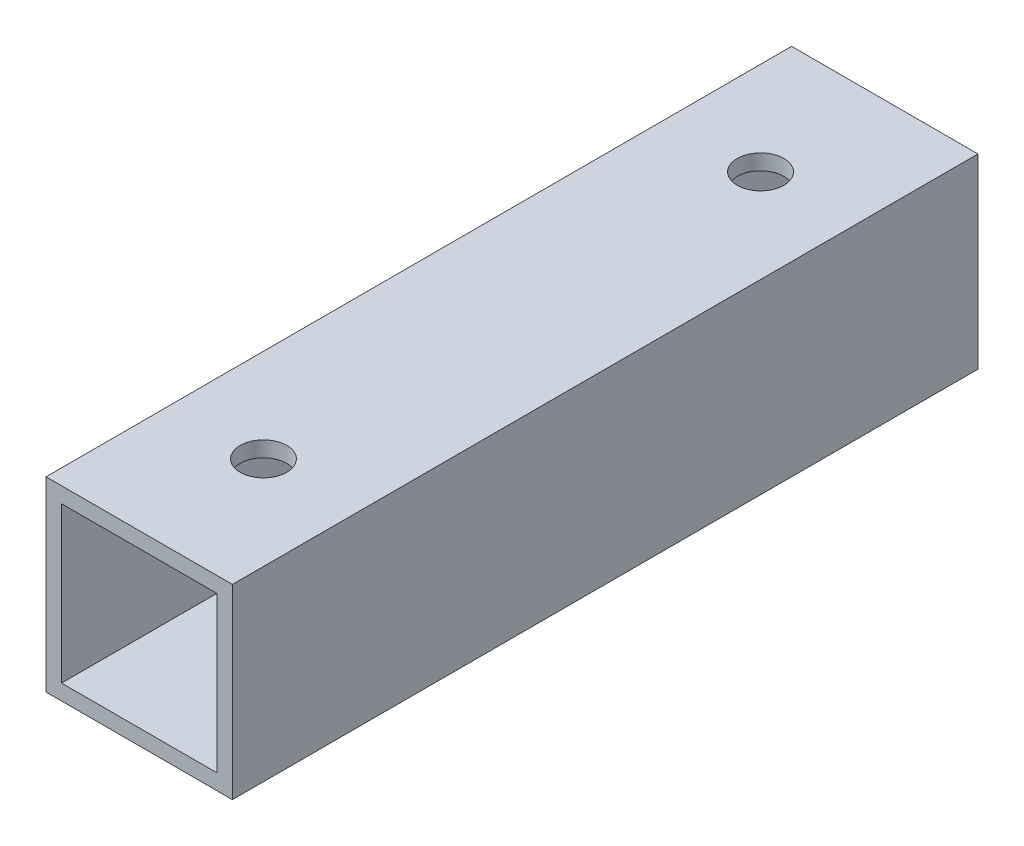
from build123d import *

# Parameters (mm, degrees)
SKETCH1_W               = 19.05
SKETCH1_H               = 19.05
SKETCH1_W_2             = 15.875
SKETCH1_H_2             = 15.875
BOSS_EXTRUDE1_DEPTH     = 76.2
CUT_EXTRUDE1_DEPTH      = 78.381465804
CUT_EXTRUDE1_DEPTH_BACK = 78.381465804
SKETCH2_R               = 2.38125
CUT_EXTRUDE2_REACH      = 81.121
SKETCH3_R               = 3.96875


with BuildPart() as part:
    # Sketch1 → Boss-Extrude1 (new body)
    with BuildSketch(Plane.XY):
        Rectangle(SKETCH1_W, SKETCH1_H)
        Rectangle(SKETCH1_W_2, SKETCH1_H_2, mode=Mode.SUBTRACT)
    extrude(amount=BOSS_EXTRUDE1_DEPTH)

    # Sketch2 → Cut-Extrude1 (cut, two sides: drawn at the far end of the back side and taken through both)
    with BuildSketch(Plane(origin=(0, 0, 0), x_dir=(1, 0, 0), z_dir=(0, 1, 0)).offset(-CUT_EXTRUDE1_DEPTH_BACK)):
        with Locations(Location((0, -12.7, 0), (0, 0, 270))):
            Circle(SKETCH2_R)
        with Locations(Location((0, -63.5, 0), (0, 0, 270))):
            Circle(SKETCH2_R)
    extrude(amount=CUT_EXTRUDE1_DEPTH + CUT_EXTRUDE1_DEPTH_BACK, mode=Mode.SUBTRACT)

    # Sketch3 → Cut-Extrude2 (cut, up to next)
    with BuildSketch(Plane.ZY.offset(9.525), mode=Mode.PRIVATE) as cut_extrude2_sk1:
        with Locations((38.1, 0)):
            Circle(SKETCH3_R)
    cut_extrude2_tool1 = extrude(cut_extrude2_sk1.sketch, amount=-CUT_EXTRUDE2_REACH, mode=Mode.PRIVATE) & part.part
    add(cut_extrude2_tool1.solids().sort_by_distance((-9.525, 0, 38.1))[0], mode=Mode.SUBTRACT)


solid = part.part
